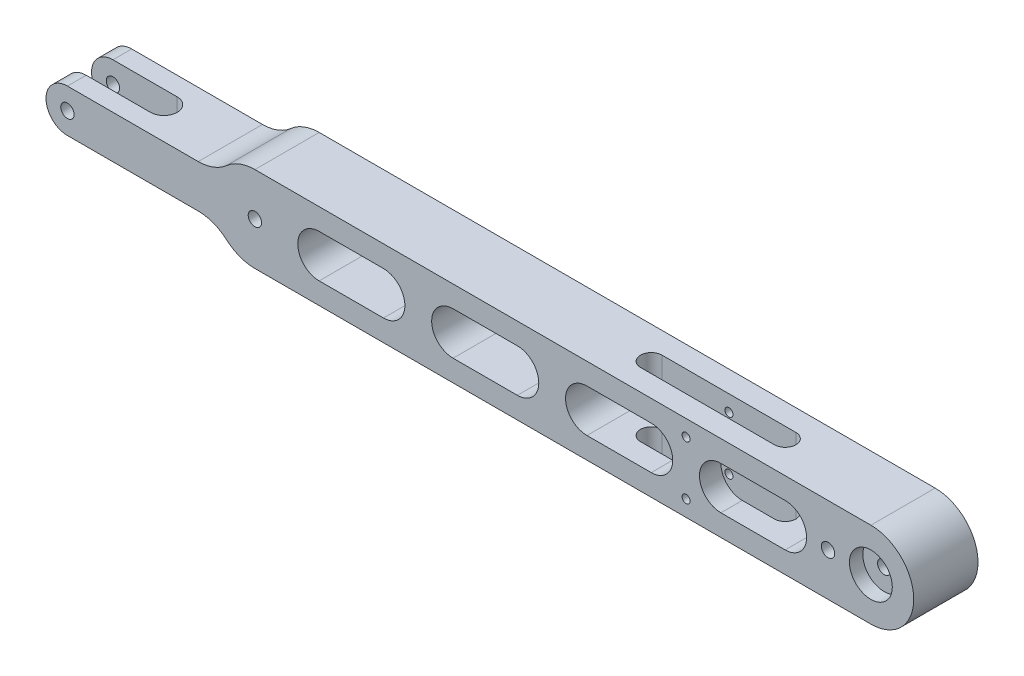
from build123d import *

# Parameters (mm, degrees)
SKETCH1_R               = 2.5
BOSS_EXTRUDE1_DEPTH     = 12
CUT_EXTRUDE1_REACH      = 249.459
CUT_EXTRUDE3_REACH      = 249.685
LPATTERN1_COUNT         = 4
LPATTERN1_PITCH         = 50
CUT_EXTRUDE4_REACH      = 249.685
SKETCH5_R               = 2.5
SKETCH6_R               = 8
CUT_EXTRUDE5_DEPTH      = 5
CUT_EXTRUDE7_DEPTH      = 248.459087528
CUT_EXTRUDE7_DEPTH_BACK = 248.459087528
SKETCH9_R               = 1.5
CUT_EXTRUDE8_DEPTH      = 248.685284181


with BuildPart() as part:
    # Sketch1 → Boss-Extrude1 (new, symmetric)
    with BuildSketch(Plane.XY):
        with BuildLine():
            Line((0, 16), (230, 16))
            ThreePointArc((230, 16), (246, 0), (230, -16))
            Line((230, -16), (0, -16))
            ThreePointArc((0, -16), (-5.656854249, -14.966629547), (-10.583005244, -12))
            ThreePointArc((-10.583005244, -12), (-15.509156239, -9.033370453), (-21.166010489, -8))
            Line((-21.166010489, -8), (-70, -8))
            ThreePointArc((-70, -8), (-78, 0), (-70, 8))
            Line((-70, 8), (-21.166010489, 8))
            ThreePointArc((-21.166010489, 8), (-15.509156239, 9.033370453), (-10.583005244, 12))
            ThreePointArc((-10.583005244, 12), (-5.656854249, 14.966629547), (0, 16))
        make_face()
        Circle(SKETCH1_R, mode=Mode.SUBTRACT)
        with Locations((-70, 0)):
            Circle(SKETCH1_R, mode=Mode.SUBTRACT)
    extrude(amount=BOSS_EXTRUDE1_DEPTH, both=True)

    # Sketch2 → Cut-Extrude1 (cut, up to next)
    with BuildSketch(Plane.XZ.offset(8), mode=Mode.PRIVATE) as cut_extrude1_sk1:
        with BuildLine():
            Line((-78, -5), (-46, -5))
            ThreePointArc((-46, -5), (-41, 0), (-46, 5))
            Line((-46, 5), (-78, 5))
            Line((-78, 5), (-78, -5))
        make_face()
    cut_extrude1_tool1 = extrude(cut_extrude1_sk1.sketch, amount=-CUT_EXTRUDE1_REACH, mode=Mode.PRIVATE) & part.part
    add(cut_extrude1_tool1.solids().sort_by_distance((-60.019172, -8, 0))[0], mode=Mode.SUBTRACT)

    # Sketch4 → Cut-Extrude3 (cut, up to next)
    with BuildSketch(Plane.XY.offset(12), mode=Mode.PRIVATE) as cut_extrude3_sk1:
        with BuildLine():
            Line((24, 8), (48, 8))
            ThreePointArc((48, 8), (56, 0), (48, -8))
            Line((48, -8), (24, -8))
            ThreePointArc((24, -8), (16, 0), (24, 8))
        make_face()
    cut_extrude3_tool1 = extrude(cut_extrude3_sk1.sketch, amount=-CUT_EXTRUDE3_REACH, mode=Mode.PRIVATE) & part.part
    cut_extrude3 = cut_extrude3_tool1.solids().sort_by_distance((36, 0, 12))[0]
    add(cut_extrude3, mode=Mode.SUBTRACT)

    # LPattern1: Cut-Extrude3 ×4
    with Locations(*[(i * LPATTERN1_PITCH, 0, 0) for i in range(1, LPATTERN1_COUNT)]):
        add(cut_extrude3, mode=Mode.SUBTRACT)

    # Sketch5 → Cut-Extrude4 (cut, up to next)
    with BuildSketch(Plane.XY.offset(12), mode=Mode.PRIVATE) as cut_extrude4_sk1:
        with Locations((230, 0)):
            Circle(SKETCH5_R)
    cut_extrude4_tool1 = extrude(cut_extrude4_sk1.sketch, amount=-CUT_EXTRUDE4_REACH, mode=Mode.PRIVATE) & part.part
    # Sketch5 → Cut-Extrude4 (cut, up to next)
    with BuildSketch(Plane.XY.offset(12), mode=Mode.PRIVATE) as cut_extrude4_sk2:
        with Locations((214, 0)):
            Circle(SKETCH5_R)
    cut_extrude4_tool2 = extrude(cut_extrude4_sk2.sketch, amount=-CUT_EXTRUDE4_REACH, mode=Mode.PRIVATE) & part.part
    add(cut_extrude4_tool1.solids().sort_by_distance((230, 0, 12))[0], mode=Mode.SUBTRACT)
    add(cut_extrude4_tool2.solids().sort_by_distance((214, 0, 12))[0], mode=Mode.SUBTRACT)

    # Sketch6 → Cut-Extrude5 (cut)
    with BuildSketch(Plane.XY.offset(12)):
        with Locations((230, 0)):
            Circle(SKETCH6_R)
    cut_extrude5 = extrude(amount=-CUT_EXTRUDE5_DEPTH, mode=Mode.SUBTRACT)

    # Mirror1: Cut-Extrude5 across plane
    add(cut_extrude5.mirror(Plane.XY), mode=Mode.SUBTRACT)

    # Sketch8 → Cut-Extrude7 (cut, two sides: drawn at the far end of the back side and taken through both)
    with BuildSketch(Plane(origin=(0, -8, 0), x_dir=(1, 0, 0), z_dir=(0, 1, 0)).offset(-CUT_EXTRUDE7_DEPTH_BACK)):
        with BuildLine():
            Line((136, 4), (186, 4))
            ThreePointArc((186, 4), (190, 0), (186, -4))
            Line((186, -4), (136, -4))
            ThreePointArc((136, -4), (132, 0), (136, 4))
        make_face()
    extrude(amount=CUT_EXTRUDE7_DEPTH + CUT_EXTRUDE7_DEPTH_BACK, mode=Mode.SUBTRACT)

    # Sketch9 → Cut-Extrude8 (cut, through all)
    with BuildSketch(Plane.XY.offset(12)):
        with Locations((161, 10)):
            Circle(SKETCH9_R)
        with Locations((161, -10)):
            Circle(SKETCH9_R)
    extrude(amount=-CUT_EXTRUDE8_DEPTH, mode=Mode.SUBTRACT)


solid = part.part
